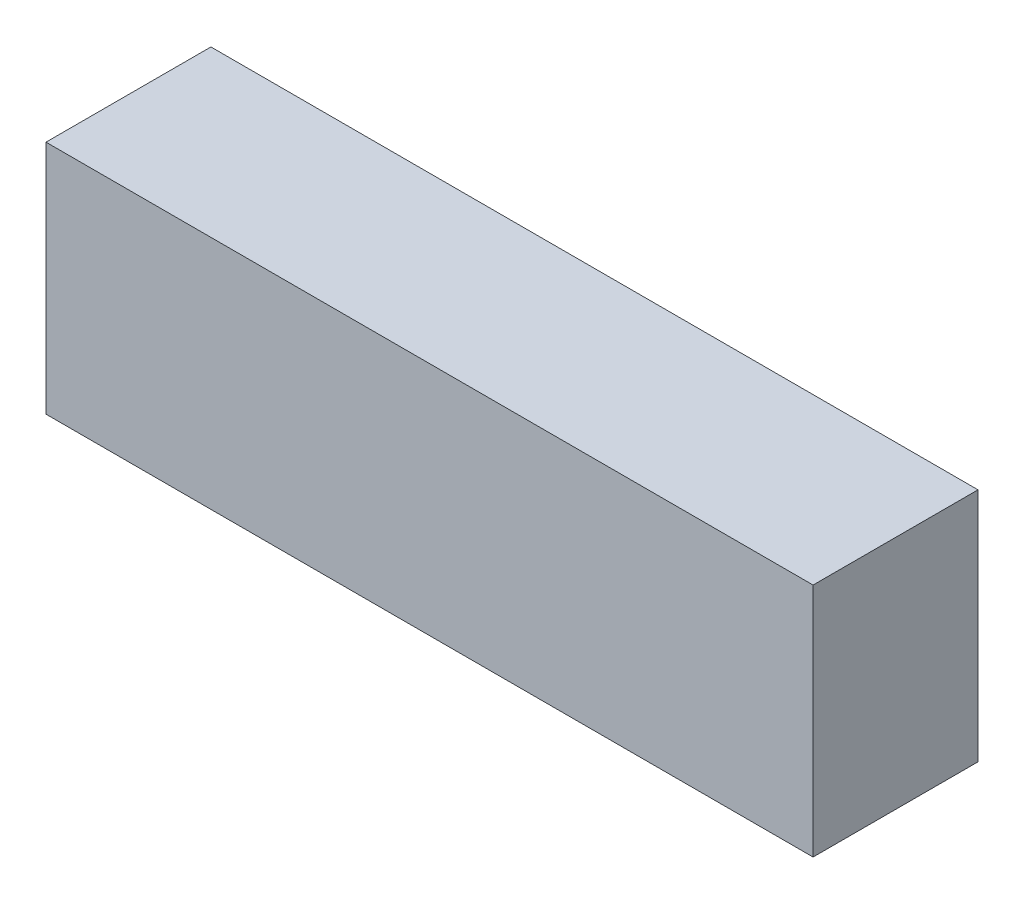
from build123d import *

# Parameters (mm, degrees)
SKETCH_1_W      = 32.559746256
SKETCH_1_H      = 10
EXTRUDE_1_DEPTH = 7


with BuildPart() as part:
    # Эскиз1 → Вытянуть1 (new body)
    with BuildSketch(Plane.XY):
        Rectangle(SKETCH_1_W, SKETCH_1_H)
    extrude(amount=EXTRUDE_1_DEPTH)


solid = part.part
